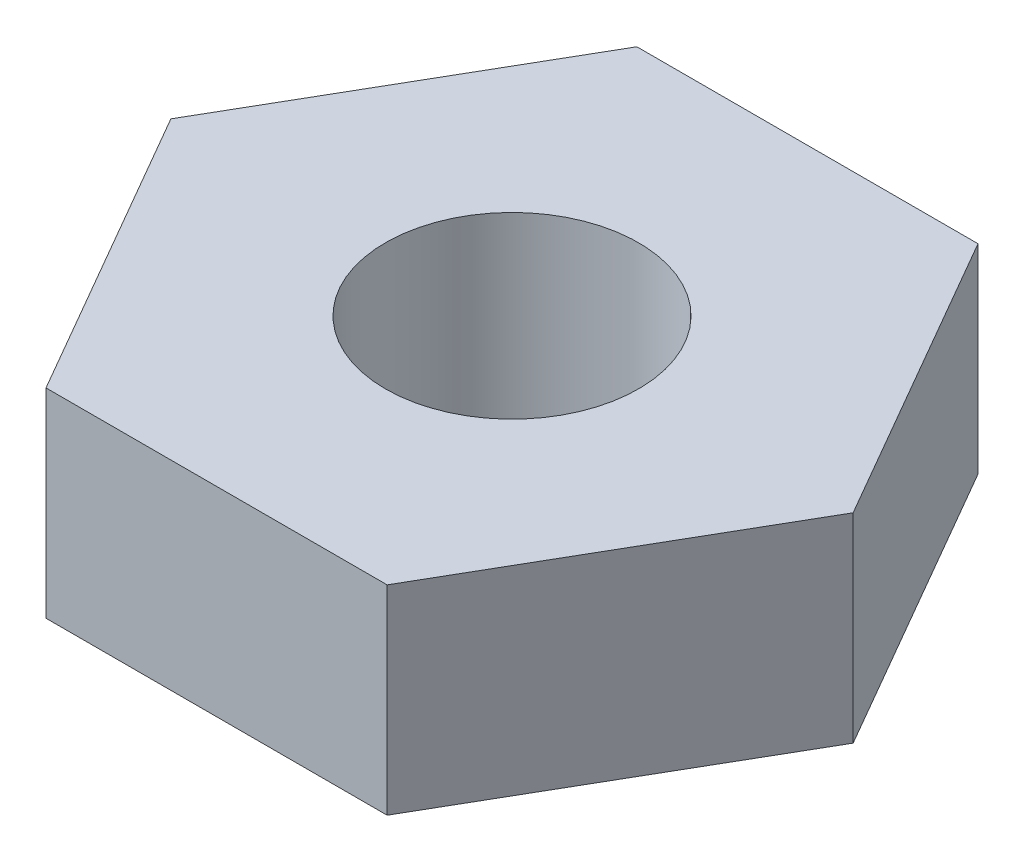
from build123d import *

# Parameters (mm, degrees)
SKETCH1_R           = 1.65
BOSS_EXTRUDE1_DEPTH = 1.3


with BuildPart() as part:
    # Sketch1 → Boss-Extrude1 (new, symmetric)
    with BuildSketch(Plane(origin=(0, 0, 0), x_dir=(1, 0, 0), z_dir=(0, 1, 0))):
        Polygon((4.445597073, 0), (2.222798536, 3.85), (-2.222798536, 3.85), (-4.445597073, 0), (-2.222798536, -3.85), (2.222798536, -3.85), align=None)
        with Locations(Location((0, 0, 0), (0, 0, 270))):
            Circle(SKETCH1_R, mode=Mode.SUBTRACT)
    extrude(amount=BOSS_EXTRUDE1_DEPTH, both=True)


solid = part.part
